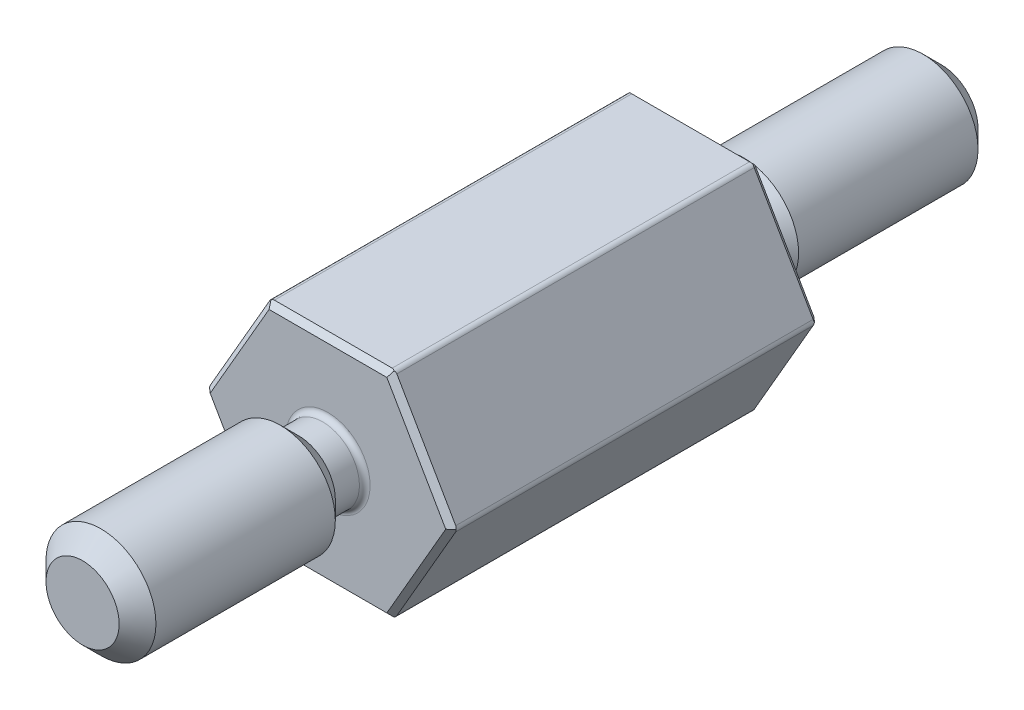
from build123d import *

# Parameters (mm, degrees)
BOSS_EXTRUDE1_DEPTH      = 4.7625
BOSS_EXTRUDE1_DEPTH_BACK = 4.7625
CHAMFER1_SIZE            = 0.13890625
FILLET1_R                = 0.13890625


with BuildPart() as part:
    # Sketch3 → Revolve1 (revolve)
    with BuildSketch(Plane(origin=(0, 0, 0), x_dir=(0, 0, -1), z_dir=(1, 0, 0)), mode=Mode.PRIVATE) as revolve1_sk:
        Polygon((11.1125, 0), (-11.1125, 0), (-11.1125, 0.94615), (-10.63625, 1.4224), (-5.9944, 1.4224), (-5.5245, 0.9525), (-4.7625, 0.9525), (-4.7625, 2.778125), (4.7625, 2.778125), (4.7625, 0.9525), (5.5245, 0.9525), (5.9944, 1.4224), (10.63625, 1.4224), (11.1125, 0.94615), align=None)
    revolve(revolve1_sk.sketch.rotate(Axis((0, 0, 11.1125), (0, 0, -1)), 90), axis=Axis((0, 0, 11.1125), (0, 0, -1)))

    # Sketch4 → Boss-Extrude1 (add, two sides: drawn at the far end of the back side and taken through both)
    with BuildSketch(Plane.XY.offset(-BOSS_EXTRUDE1_DEPTH_BACK)):
        Polygon((-3.207902433, 0), (-1.603951217, -2.778125), (1.603951217, -2.778125), (3.207902433, 0), (1.603951217, 2.778125), (-1.603951217, 2.778125), align=None)
    extrude(amount=BOSS_EXTRUDE1_DEPTH + BOSS_EXTRUDE1_DEPTH_BACK)

    # Chamfer1
    chamfer1_edges = [part.edges().sort_by_distance(p)[0] for p in [
        (2.405926825, 1.3890625, 4.7625),
        (0, 2.778125, 4.7625),
        (-2.405926825, 1.3890625, 4.7625),
        (-2.405926825, -1.3890625, 4.7625),
        (0, -2.778125, 4.7625),
        (2.405926825, -1.3890625, 4.7625),
        (-2.405926825, 1.3890625, -4.7625),
        (0, 2.778125, -4.7625),
        (2.405926825, 1.3890625, -4.7625),
        (2.405926825, -1.3890625, -4.7625),
        (0, -2.778125, -4.7625),
        (-2.405926825, -1.3890625, -4.7625),
    ]]
    chamfer(chamfer1_edges, length=CHAMFER1_SIZE)

    # Fillet1
    fillet1_edges = [part.edges().sort_by_distance(p)[0] for p in [
        (-0.9525, 0, -4.7625),
        (-0.9525, 0, 4.7625),
        (-3.207902433, 0, 0),
        (-1.603951217, 2.778125, 0),
        (-1.603951217, -2.778125, 0),
        (1.603951217, -2.778125, 0),
        (3.207902433, 0, 0),
        (1.603951217, 2.778125, 0),
    ]]
    fillet(fillet1_edges, radius=FILLET1_R)


solid = part.part
